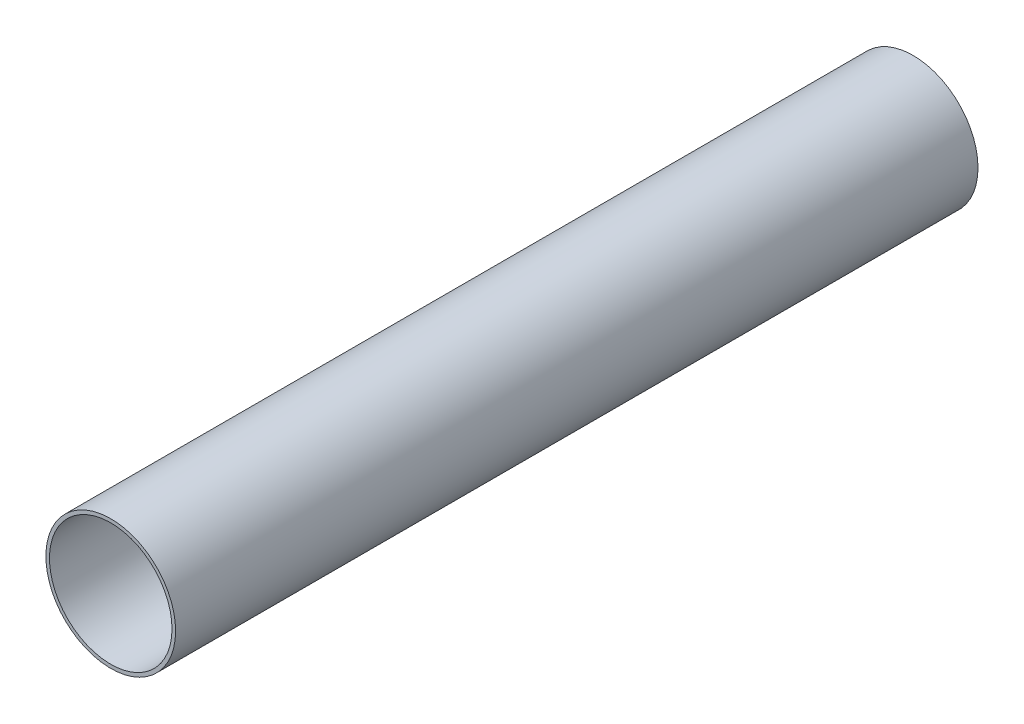
from build123d import *

# Parameters (mm, degrees)
ESBO_O1_R                = 22.23
ESBO_O1_R_2              = 21
RESSALTO_EXTRUS_O1_DEPTH = 275


with BuildPart() as part:
    # Esboço1 → Ressalto-extrusão1 (new body)
    with BuildSketch(Plane.XY):
        Circle(ESBO_O1_R)
        Circle(ESBO_O1_R_2, mode=Mode.SUBTRACT)
    extrude(amount=RESSALTO_EXTRUS_O1_DEPTH)


solid = part.part
